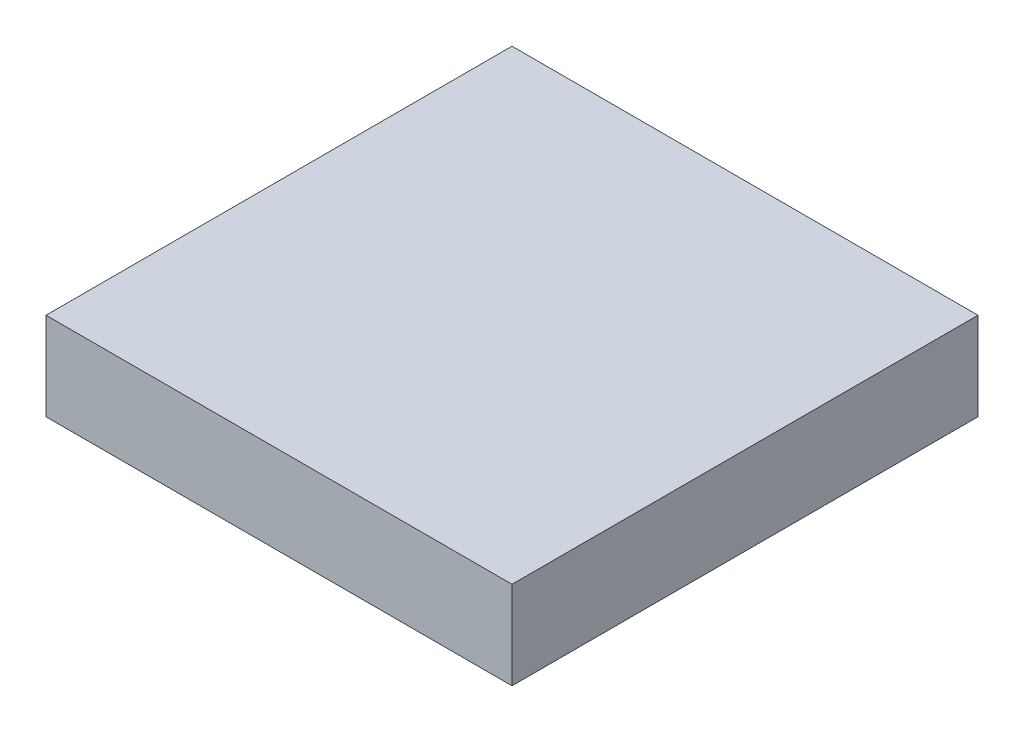
from build123d import *

# Parameters (mm, degrees)
SKETCH1_W           = 53
SKETCH1_H           = 53
BOSS_EXTRUDE1_DEPTH = 10


with BuildPart() as part:
    # Sketch1 → Boss-Extrude1 (new body)
    with BuildSketch(Plane(origin=(0, 0, 0), x_dir=(1, 0, 0), z_dir=(0, 1, 0))):
        with Locations((-1.707371429, 18.906049929)):
            Rectangle(SKETCH1_W, SKETCH1_H)
    extrude(amount=BOSS_EXTRUDE1_DEPTH)


solid = part.part
